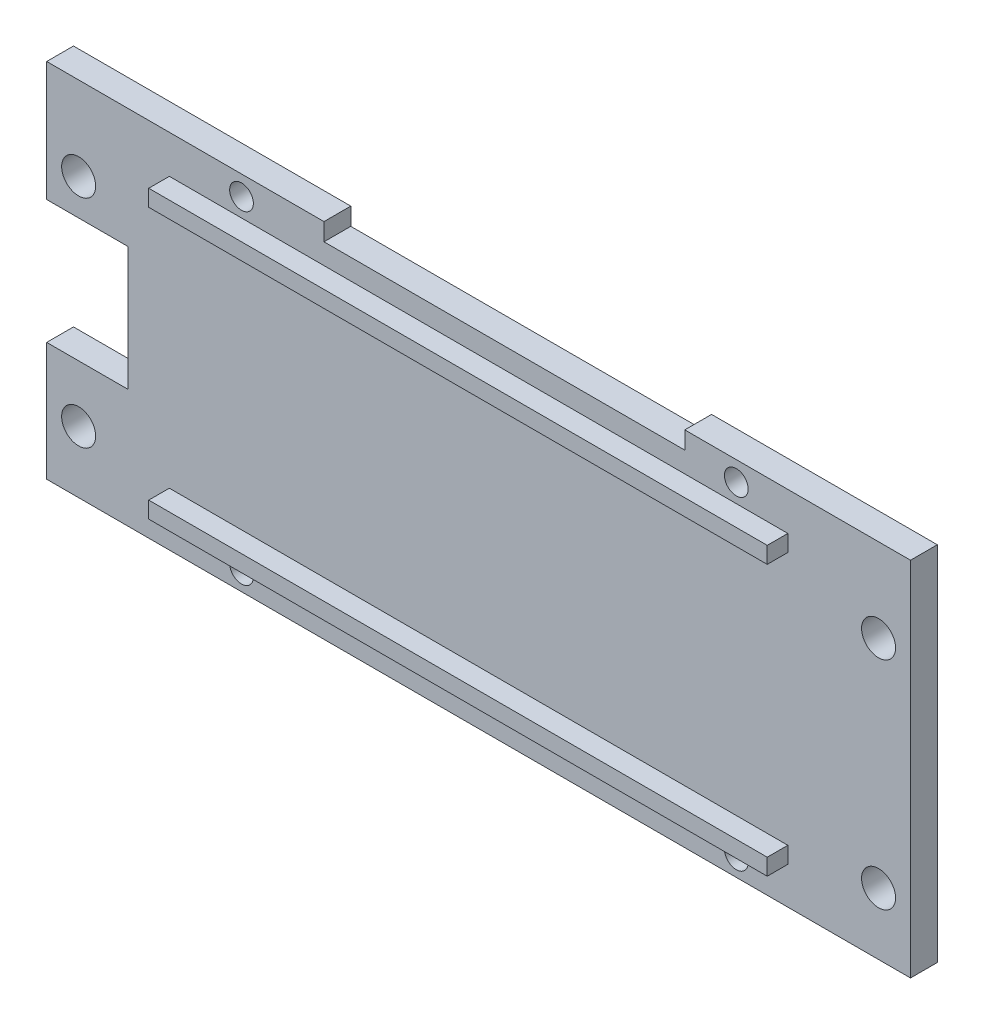
from build123d import *

# Parameters (mm, degrees)
F_2_6_MM_REMOVABLE_SHELF_WIRING_NOTC_2_R       = 1.65
F_2_6_MM_REMOVABLE_SHELF_WIRING_NOTC_2_R_2     = 1.15
F_2_6_MM_REMOVABLE_SHELF_WIRING_NOTCH_AN_DEPTH = 2.6
CONTROLLER_START                               = 2.6
CONTROLLER_BOARD_EDGE_RESTS_PROFILE_W          = 60
CONTROLLER_BOARD_EDGE_RESTS_PROFILE_H          = 1.6
CONTROLLER_BOARD_EDGE_RESTS_DEPTH              = 2


with BuildPart() as part:
    # 2.6 mm removable shelf - wiring notc 2 → 2.6 mm removable shelf - wiring notch an (new body)
    with BuildSketch(Plane.XY):
        Polygon((-41.9, -24.5), (41.9, -24.5), (41.9, 10.6), (20, 10.6), (20, 8.9), (-15, 8.9), (-15, 10.6), (-41.9, 10.6), (-41.9, -1), (-34, -1), (-34, -13), (-41.9, -13), align=None)
        with Locations((-38.8, -18.5)):
            Circle(F_2_6_MM_REMOVABLE_SHELF_WIRING_NOTC_2_R, mode=Mode.SUBTRACT)
        with Locations((38.8, -18.5)):
            Circle(F_2_6_MM_REMOVABLE_SHELF_WIRING_NOTC_2_R, mode=Mode.SUBTRACT)
        with Locations((-38.8, 2.5)):
            Circle(F_2_6_MM_REMOVABLE_SHELF_WIRING_NOTC_2_R, mode=Mode.SUBTRACT)
        with Locations((38.8, 2.5)):
            Circle(F_2_6_MM_REMOVABLE_SHELF_WIRING_NOTC_2_R, mode=Mode.SUBTRACT)
        with Locations((-23, -22.7)):
            Circle(F_2_6_MM_REMOVABLE_SHELF_WIRING_NOTC_2_R_2, mode=Mode.SUBTRACT)
        with Locations((25, -22.7)):
            Circle(F_2_6_MM_REMOVABLE_SHELF_WIRING_NOTC_2_R_2, mode=Mode.SUBTRACT)
        with Locations((-23, 8.7)):
            Circle(F_2_6_MM_REMOVABLE_SHELF_WIRING_NOTC_2_R_2, mode=Mode.SUBTRACT)
        with Locations((25, 8.7)):
            Circle(F_2_6_MM_REMOVABLE_SHELF_WIRING_NOTC_2_R_2, mode=Mode.SUBTRACT)
    extrude(amount=F_2_6_MM_REMOVABLE_SHELF_WIRING_NOTCH_AN_DEPTH)

    # Controller board edge rests profile → Controller board edge rests (add)
    with BuildSketch(Plane.XY.offset(CONTROLLER_START)):
        with Locations((0, -20.1)):
            Rectangle(CONTROLLER_BOARD_EDGE_RESTS_PROFILE_W, CONTROLLER_BOARD_EDGE_RESTS_PROFILE_H)
        with Locations((0, 6.1)):
            Rectangle(CONTROLLER_BOARD_EDGE_RESTS_PROFILE_W, CONTROLLER_BOARD_EDGE_RESTS_PROFILE_H)
    extrude(amount=CONTROLLER_BOARD_EDGE_RESTS_DEPTH)


solid = part.part
